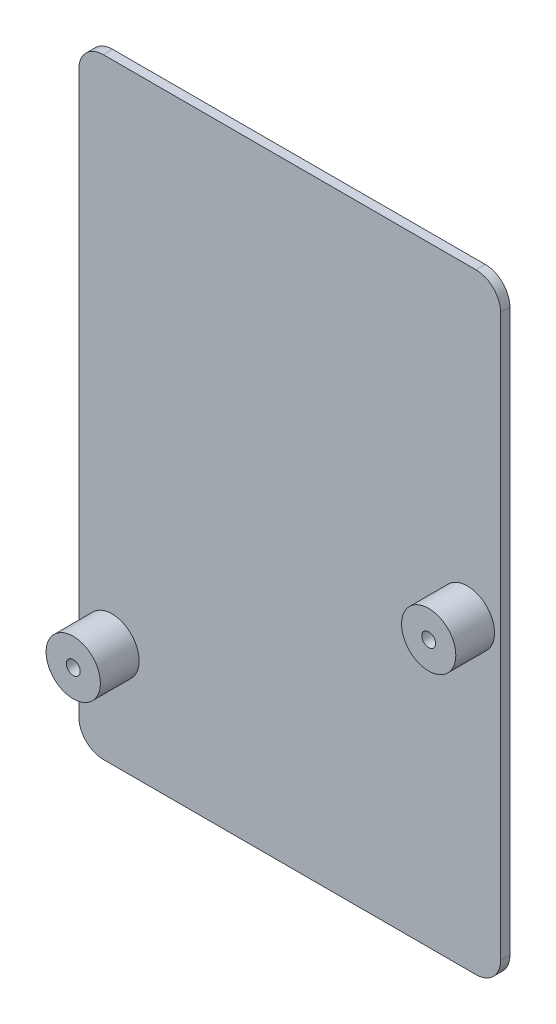
from build123d import *

# Parameters (mm, degrees)
SKETCH1_W                      = 54.4068
SKETCH1_H                      = 78.74
BOSS_EXTRUDE1_DEPTH            = 1.2
FILLET1_R                      = 3.175
CUT_EXTRUDE1_REACH             = 49.869
SKETCH2_R                      = 0.89
CUT_EXTRUDE1_DIRECTION_2_DEPTH = 48.869216325
BOSS_EXTRUDE2_START            = 5
SKETCH4_R                      = 3.5
SKETCH4_R_2                    = 0.89
BOSS_EXTRUDE2_DEPTH            = 5


with BuildPart() as part:
    # Sketch1 → Boss-Extrude1 (new body)
    with BuildSketch(Plane.XY):
        Rectangle(SKETCH1_W, SKETCH1_H)
    extrude(amount=BOSS_EXTRUDE1_DEPTH)

    # Fillet1
    fillet1_edges = [part.edges().sort_by_distance(p)[0] for p in [
        (27.2034, -39.37, 0.6),
        (-27.2034, -39.37, 0.6),
        (-27.2034, 39.37, 0.6),
        (27.2034, 39.37, 0.6),
    ]]
    fillet(fillet1_edges, radius=FILLET1_R)

    # Sketch2 → Cut-Extrude1 (cut, up to next)
    with BuildSketch(Plane.XY.offset(1.2), mode=Mode.PRIVATE) as cut_extrude1_sk1:
        with Locations(Location((-22.925, -26.04, 0), (0, 0, 180))):
            Circle(SKETCH2_R)
    cut_extrude1_tool1 = extrude(cut_extrude1_sk1.sketch, amount=-CUT_EXTRUDE1_REACH, mode=Mode.PRIVATE) & part.part
    # Sketch2 → Cut-Extrude1 (cut, up to next)
    with BuildSketch(Plane.XY.offset(1.2), mode=Mode.PRIVATE) as cut_extrude1_sk2:
        with Locations(Location((22.925, 0, 0), (0, 0, 180))):
            Circle(SKETCH2_R)
    cut_extrude1_tool2 = extrude(cut_extrude1_sk2.sketch, amount=-CUT_EXTRUDE1_REACH, mode=Mode.PRIVATE) & part.part
    add(cut_extrude1_tool1.solids().sort_by_distance((-22.925, -26.04, 1.2))[0], mode=Mode.SUBTRACT)
    add(cut_extrude1_tool2.solids().sort_by_distance((22.925, 0, 1.2))[0], mode=Mode.SUBTRACT)

    # Sketch2 → Cut-Extrude1 direction 2 (cut)
    with BuildSketch(Plane.XY.offset(1.2)):
        with Locations(Location((-22.925, -26.04, 0), (0, 0, 180))):
            Circle(SKETCH2_R)
        with Locations(Location((22.925, 0, 0), (0, 0, 180))):
            Circle(SKETCH2_R)
    extrude(amount=CUT_EXTRUDE1_DIRECTION_2_DEPTH, mode=Mode.SUBTRACT)

    # Sketch4 → Boss-Extrude2 (add)
    # profile 1 of 2: a face of its own
    with BuildSketch(Plane.XY.offset(1.2).offset(BOSS_EXTRUDE2_START)):
        with Locations(Location((-22.925, -26.04, 0), (0, 0, 180))):
            Circle(SKETCH4_R)
        with Locations(Location((-22.925, -26.04, 0), (0, 0, 180))):
            Circle(SKETCH4_R_2, mode=Mode.SUBTRACT)
    # profile 2 of 2: a face of its own
    with BuildSketch(Plane.XY.offset(1.2).offset(BOSS_EXTRUDE2_START)):
        with Locations(Location((22.925, 0, 0), (0, 0, 180))):
            Circle(SKETCH4_R)
        with Locations(Location((22.925, 0, 0), (0, 0, 180))):
            Circle(SKETCH4_R_2, mode=Mode.SUBTRACT)
    extrude(amount=-BOSS_EXTRUDE2_DEPTH)


solid = part.part
